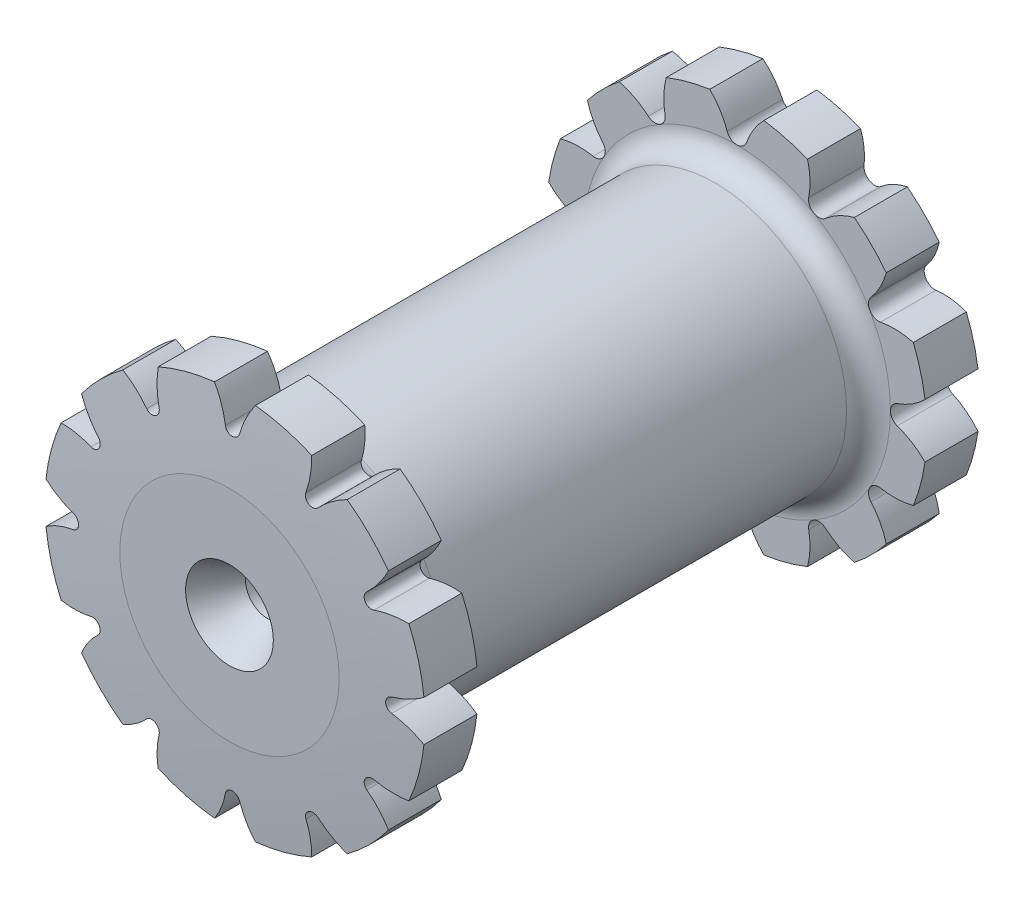
from build123d import *

# Parameters (mm, degrees)
CUT_EXTRUDE1_DEPTH = 5.3
CIRPATTERN1_COUNT  = 12
CUT_EXTRUDE2_START = -4
CUT_EXTRUDE2_DEPTH = 4
CIRPATTERN2_COUNT  = 12


with BuildPart() as part:
    # Sketch1 → Revolve1 (revolve)
    with BuildSketch(Plane(origin=(0, 0, 0), x_dir=(0, 0, -1), z_dir=(1, 0, 0)), mode=Mode.PRIVATE) as revolve1_sk:
        with BuildLine():
            Line((0.376777805, 13), (4, 13))
            Line((4, 13), (4, 10.5))
            ThreePointArc((4, 10.5), (4.439339828, 9.439339828), (5.5, 9))
            Line((5.5, 9), (33.2, 9))
            ThreePointArc((33.2, 9), (34.260660172, 9.439339828), (34.7, 10.5))
            Line((34.7, 10.5), (34.7, 13))
            Line((34.7, 13), (38.323222195, 13))
            ThreePointArc((38.323222195, 13), (38.536880646, 10.251731092), (38.7, 7.5))
            Line((38.7, 7.5), (38.7, 0))
            Line((38.7, 0), (0, 0))
            Line((0, 0), (0, 7.5))
            ThreePointArc((0, 7.5), (0.163119354, 10.251731092), (0.376777805, 13))
        make_face()
    revolve(revolve1_sk.sketch.rotate(Axis((0, 0, 0), (0, 0, -1)), 90), axis=Axis((0, 0, 0), (0, 0, -1)))

    # Sketch2 → Cut-Revolve1 (revolve, cut)
    with BuildSketch(Plane(origin=(0, 0, 0), x_dir=(0, 0, -1), z_dir=(1, 0, 0))):
        Polygon((38.7, 3), (36.101923789, 1.5), (33.601290929, 1.5), (32.7, 0), (38.7, 0), align=None)
    revolve(axis=Axis((0, 0, 0), (0, 0, -1)), mode=Mode.SUBTRACT)

    # Sketch3 → Cut-Revolve2 (revolve, cut)
    with BuildSketch(Plane(origin=(0, 0, 0), x_dir=(0, 0, -1), z_dir=(1, 0, 0)), mode=Mode.PRIVATE) as cut_revolve2_sk:
        Polygon((0, 3), (2.598076211, 1.5), (5.098709071, 1.5), (6, 0), (0, 0), align=None)
    revolve(cut_revolve2_sk.sketch.rotate(Axis((0, 0, 0), (0, 0, -1)), 90), axis=Axis((0, 0, 0), (0, 0, -1)), mode=Mode.SUBTRACT)

    # Sketch4 → Cut-Extrude1 (cut)
    with BuildSketch(Plane.XY.offset(-40)):
        with BuildLine():
            ThreePointArc((-0.661332331, 10.970566898), (0, 10.5), (0.661332331, 10.970566898))
            ThreePointArc((0.661332331, 10.970566898), (1.148121437, 11.986513002), (1.85, 12.867692101))
            ThreePointArc((1.85, 12.867692101), (0, 13), (-1.85, 12.867692101))
            ThreePointArc((-1.85, 12.867692101), (-1.148121437, 11.986513002), (-0.661332331, 10.970566898))
        make_face()
    cut_extrude1 = extrude(amount=CUT_EXTRUDE1_DEPTH, mode=Mode.SUBTRACT)

    # CirPattern1: Cut-Extrude1 ×12 about axis
    cirpattern1_axis = Axis((0, 0, 0), (0, 0, 1))
    for i in range(1, CIRPATTERN1_COUNT):
        add(cut_extrude1.rotate(cirpattern1_axis, i * 360 / CIRPATTERN1_COUNT), mode=Mode.SUBTRACT)

    # Sketch5 → Cut-Extrude2 (cut)
    with BuildSketch(Plane.XY.offset(CUT_EXTRUDE2_START)):
        with BuildLine():
            ThreePointArc((1.4, 12.924395537), (0, 13), (-1.4, 12.924395537))
            ThreePointArc((-1.4, 12.924395537), (-0.84461094, 11.950118504), (-0.487102925, 10.887169415))
            ThreePointArc((-0.487102925, 10.887169415), (0, 10.5), (0.487102925, 10.887169415))
            ThreePointArc((0.487102925, 10.887169415), (0.84461094, 11.950118504), (1.4, 12.924395537))
        make_face()
    cut_extrude2 = extrude(amount=CUT_EXTRUDE2_DEPTH, mode=Mode.SUBTRACT)

    # CirPattern2: Cut-Extrude2 ×12 about axis
    cirpattern2_axis = Axis((0, 0, 0), (0, 0, 1))
    for i in range(1, CIRPATTERN2_COUNT):
        add(cut_extrude2.rotate(cirpattern2_axis, i * 360 / CIRPATTERN2_COUNT), mode=Mode.SUBTRACT)


solid = part.part
